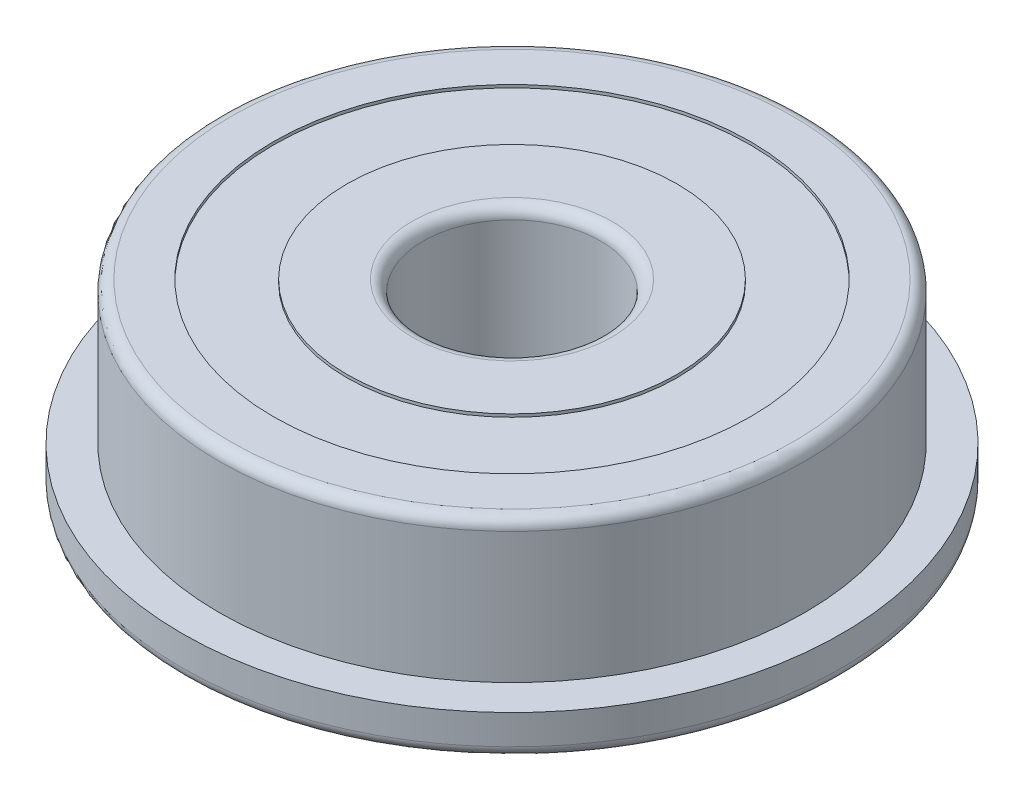
from build123d import *

# Parameters (mm, degrees)
SKETCH1_R           = 8.985
BOSS_EXTRUDE1_DEPTH = 1.12
SKETCH2_R           = 7.985
BOSS_EXTRUDE2_DEPTH = 3.88
SKETCH3_R           = 2.42
CUT_EXTRUDE1_DEPTH  = 14.655052179
SKETCH4_R           = 6.5
SKETCH4_R_2         = 4.5
CUT_EXTRUDE2_DEPTH  = 0.08
CUT_EXTRUDE3_START  = -0.08
SKETCH5_R           = 6.5
SKETCH5_R_2         = 4.5
CUT_EXTRUDE3_DEPTH  = 0.08
FILLET1_R           = 0.31


with BuildPart() as part:
    # Sketch1 → Boss-Extrude1 (new body)
    with BuildSketch(Plane(origin=(0, 0, 0), x_dir=(1, 0, 0), z_dir=(0, 1, 0))):
        with Locations(Location((0, 0, 0), (0, 0, 270))):
            Circle(SKETCH1_R)
    extrude(amount=BOSS_EXTRUDE1_DEPTH)

    # Sketch2 → Boss-Extrude2 (add)
    with BuildSketch(Plane(origin=(0, 1.12, 0), x_dir=(1, 0, 0), z_dir=(0, 1, 0))):
        with Locations(Location((0, 0, 0), (0, 0, 270))):
            Circle(SKETCH2_R)
    extrude(amount=BOSS_EXTRUDE2_DEPTH)

    # Sketch3 → Cut-Extrude1 (cut, through all)
    with BuildSketch(Plane(origin=(0, 5, 0), x_dir=(1, 0, 0), z_dir=(0, 1, 0))):
        with Locations(Location((0, 0, 0), (0, 0, 270))):
            Circle(SKETCH3_R)
    extrude(amount=-CUT_EXTRUDE1_DEPTH, mode=Mode.SUBTRACT)

    # Sketch4 → Cut-Extrude2 (cut)
    with BuildSketch(Plane.XZ):
        with Locations(Location((0, 0, 0), (0, 0, 270))):
            Circle(SKETCH4_R)
        with Locations(Location((0, 0, 0), (0, 0, 270))):
            Circle(SKETCH4_R_2, mode=Mode.SUBTRACT)
    extrude(amount=-CUT_EXTRUDE2_DEPTH, mode=Mode.SUBTRACT)

    # Sketch5 → Cut-Extrude3 (cut)
    with BuildSketch(Plane(origin=(0, 5, 0), x_dir=(1, 0, 0), z_dir=(0, 1, 0)).offset(CUT_EXTRUDE3_START)):
        with Locations(Location((0, 0, 0), (0, 0, 90))):
            Circle(SKETCH5_R)
        with Locations(Location((0, 0, 0), (0, 0, 90))):
            Circle(SKETCH5_R_2, mode=Mode.SUBTRACT)
    extrude(amount=CUT_EXTRUDE3_DEPTH, mode=Mode.SUBTRACT)

    # Fillet1
    fillet1_edges = [part.edges().sort_by_distance(p)[0] for p in [
        (0, 0, -2.42),
        (0, 5, -2.42),
        (0, 0, -8.985),
        (0, 5, -7.985),
    ]]
    fillet(fillet1_edges, radius=FILLET1_R)


solid = part.part
